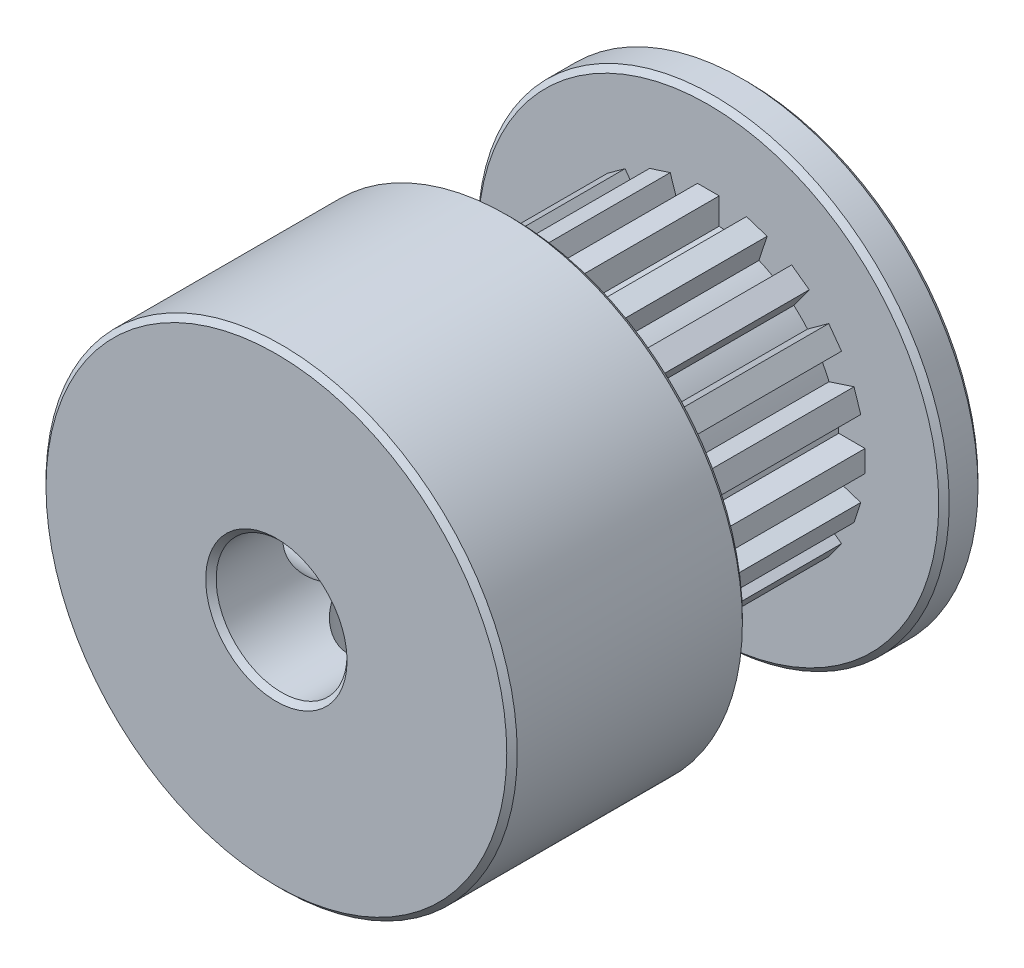
from build123d import *

# Parameters (mm, degrees)
SKETCH_1_R          = 9
SKETCH_1_R_2        = 2.5
EXTRUDE_1_DEPTH     = 1.5
SKETCH_2_R          = 2.5
EXTRUDE_2_DEPTH     = 7.5
SKETCH_3_R          = 9
SKETCH_3_R_2        = 2.5
EXTRUDE_3_DEPTH     = 9
CHAMFER_2_SIZE      = 0.2
SKETCH_4_R          = 1.75
CUT_EXTRUDE_1_DEPTH = 10
SKETCH_5_R          = 1.75
CUT_EXTRUDE_2_DEPTH = 10


with BuildPart() as part:
    # 草图1 → 凸台-拉伸1 (new body)
    with BuildSketch(Plane.XY):
        Circle(SKETCH_1_R)
        Circle(SKETCH_1_R_2, mode=Mode.SUBTRACT)
    extrude(amount=EXTRUDE_1_DEPTH)

    # 草图2 → 凸台-拉伸2 (add)
    with BuildSketch(Plane.XY.offset(1.5)):
        with BuildLine():
            Line((-0.415, 5.98563071), (-0.415, 4.982747736))
            ThreePointArc((-0.415, 4.982747736), (-0.782172325, 4.938441703), (-1.145065275, 4.867116756))
            Line((-1.145065275, 4.867116756), (-1.454973157, 5.820915144))
            Line((-1.454973157, 5.820915144), (-2.244350066, 5.564431038))
            Line((-2.244350066, 5.564431038), (-1.934442183, 4.610632651))
            ThreePointArc((-1.934442183, 4.610632651), (-2.269952499, 4.455032621), (-2.593043582, 4.275058477))
            Line((-2.593043582, 4.275058477), (-3.182523405, 5.086407846))
            Line((-3.182523405, 5.086407846), (-3.85400751, 4.598546087))
            Line((-3.85400751, 4.598546087), (-3.264527688, 3.787196717))
            ThreePointArc((-3.264527688, 3.787196717), (-3.535533906, 3.535533906), (-3.787196717, 3.264527688))
            Line((-3.787196717, 3.264527688), (-4.598546087, 3.85400751))
            Line((-4.598546087, 3.85400751), (-5.086407846, 3.182523405))
            Line((-5.086407846, 3.182523405), (-4.275058477, 2.593043582))
            ThreePointArc((-4.275058477, 2.593043582), (-4.455032621, 2.269952499), (-4.610632651, 1.934442183))
            Line((-4.610632651, 1.934442183), (-5.564431038, 2.244350066))
            Line((-5.564431038, 2.244350066), (-5.820915144, 1.454973157))
            Line((-5.820915144, 1.454973157), (-4.867116756, 1.145065275))
            ThreePointArc((-4.867116756, 1.145065275), (-4.938441703, 0.782172325), (-4.982747736, 0.415))
            Line((-4.982747736, 0.415), (-5.98563071, 0.415))
            Line((-5.98563071, 0.415), (-5.98563071, -0.415))
            Line((-5.98563071, -0.415), (-4.982747736, -0.415))
            ThreePointArc((-4.982747736, -0.415), (-4.938441703, -0.782172325), (-4.867116756, -1.145065275))
            Line((-4.867116756, -1.145065275), (-5.820915144, -1.454973157))
            Line((-5.820915144, -1.454973157), (-5.564431038, -2.244350066))
            Line((-5.564431038, -2.244350066), (-4.610632651, -1.934442183))
            ThreePointArc((-4.610632651, -1.934442183), (-4.455032621, -2.269952499), (-4.275058477, -2.593043582))
            Line((-4.275058477, -2.593043582), (-5.086407846, -3.182523405))
            Line((-5.086407846, -3.182523405), (-4.598546087, -3.85400751))
            Line((-4.598546087, -3.85400751), (-3.787196717, -3.264527688))
            ThreePointArc((-3.787196717, -3.264527688), (-3.535533906, -3.535533906), (-3.264527688, -3.787196717))
            Line((-3.264527688, -3.787196717), (-3.85400751, -4.598546087))
            Line((-3.85400751, -4.598546087), (-3.182523405, -5.086407846))
            Line((-3.182523405, -5.086407846), (-2.593043582, -4.275058477))
            ThreePointArc((-2.593043582, -4.275058477), (-2.269952499, -4.455032621), (-1.934442183, -4.610632651))
            Line((-1.934442183, -4.610632651), (-2.244350066, -5.564431038))
            Line((-2.244350066, -5.564431038), (-1.454973157, -5.820915144))
            Line((-1.454973157, -5.820915144), (-1.145065275, -4.867116756))
            ThreePointArc((-1.145065275, -4.867116756), (-0.782172325, -4.938441703), (-0.415, -4.982747736))
            Line((-0.415, -4.982747736), (-0.415, -5.98563071))
            Line((-0.415, -5.98563071), (0.415, -5.98563071))
            Line((0.415, -5.98563071), (0.415, -4.982747736))
            ThreePointArc((0.415, -4.982747736), (0.782172325, -4.938441703), (1.145065275, -4.867116756))
            Line((1.145065275, -4.867116756), (1.454973157, -5.820915144))
            Line((1.454973157, -5.820915144), (2.244350066, -5.564431038))
            Line((2.244350066, -5.564431038), (1.934442183, -4.610632651))
            ThreePointArc((1.934442183, -4.610632651), (2.269952499, -4.455032621), (2.593043582, -4.275058477))
            Line((2.593043582, -4.275058477), (3.182523405, -5.086407846))
            Line((3.182523405, -5.086407846), (3.85400751, -4.598546087))
            Line((3.85400751, -4.598546087), (3.264527688, -3.787196717))
            ThreePointArc((3.264527688, -3.787196717), (3.535533906, -3.535533906), (3.787196717, -3.264527688))
            Line((3.787196717, -3.264527688), (4.598546087, -3.85400751))
            Line((4.598546087, -3.85400751), (5.086407846, -3.182523405))
            Line((5.086407846, -3.182523405), (4.275058477, -2.593043582))
            ThreePointArc((4.275058477, -2.593043582), (4.455032621, -2.269952499), (4.610632651, -1.934442183))
            Line((4.610632651, -1.934442183), (5.564431038, -2.244350066))
            Line((5.564431038, -2.244350066), (5.820915144, -1.454973157))
            Line((5.820915144, -1.454973157), (4.867116756, -1.145065275))
            ThreePointArc((4.867116756, -1.145065275), (4.938441703, -0.782172325), (4.982747736, -0.415))
            Line((4.982747736, -0.415), (5.98563071, -0.415))
            Line((5.98563071, -0.415), (5.98563071, 0.415))
            Line((5.98563071, 0.415), (4.982747736, 0.415))
            ThreePointArc((4.982747736, 0.415), (4.938441703, 0.782172325), (4.867116756, 1.145065275))
            Line((4.867116756, 1.145065275), (5.820915144, 1.454973157))
            Line((5.820915144, 1.454973157), (5.564431038, 2.244350066))
            Line((5.564431038, 2.244350066), (4.610632651, 1.934442183))
            ThreePointArc((4.610632651, 1.934442183), (4.455032621, 2.269952499), (4.275058477, 2.593043582))
            Line((4.275058477, 2.593043582), (5.086407846, 3.182523405))
            Line((5.086407846, 3.182523405), (4.598546087, 3.85400751))
            Line((4.598546087, 3.85400751), (3.787196717, 3.264527688))
            ThreePointArc((3.787196717, 3.264527688), (3.535533906, 3.535533906), (3.264527688, 3.787196717))
            Line((3.264527688, 3.787196717), (3.85400751, 4.598546087))
            Line((3.85400751, 4.598546087), (3.182523405, 5.086407846))
            Line((3.182523405, 5.086407846), (2.593043582, 4.275058477))
            ThreePointArc((2.593043582, 4.275058477), (2.269952499, 4.455032621), (1.934442183, 4.610632651))
            Line((1.934442183, 4.610632651), (2.244350066, 5.564431038))
            Line((2.244350066, 5.564431038), (1.454973157, 5.820915144))
            Line((1.454973157, 5.820915144), (1.145065275, 4.867116756))
            ThreePointArc((1.145065275, 4.867116756), (0.782172325, 4.938441703), (0.415, 4.982747736))
            Line((0.415, 4.982747736), (0.415, 5.98563071))
            Line((0.415, 5.98563071), (-0.415, 5.98563071))
        make_face()
        Circle(SKETCH_2_R, mode=Mode.SUBTRACT)
    extrude(amount=EXTRUDE_2_DEPTH)

    # 草图3 → 凸台-拉伸3 (add)
    with BuildSketch(Plane.XY.offset(9)):
        Circle(SKETCH_3_R)
        Circle(SKETCH_3_R_2, mode=Mode.SUBTRACT)
    extrude(amount=EXTRUDE_3_DEPTH)

    # 倒角2
    chamfer_2_edges = [part.edges().sort_by_distance(p)[0] for p in [
        (-9, 0, 0),
        (-9, 0, 18),
        (-9, 0, 9),
        (-2.5, 0, 18),
        (-9, 0, 1.5),
        (-2.5, 0, 0),
    ]]
    chamfer(chamfer_2_edges, length=CHAMFER_2_SIZE)

    # 草图4 → 切除-拉伸1 (cut)
    with BuildSketch(Plane(origin=(0, 0, 0), x_dir=(1, 0, 0), z_dir=(0, 1, 0))):
        with Locations(Location((0, -13.5, 0), (0, 0, 270))):
            Circle(SKETCH_4_R)
    extrude(amount=-CUT_EXTRUDE_1_DEPTH, mode=Mode.SUBTRACT)

    # 草图5 → 切除-拉伸2 (cut)
    with BuildSketch(Plane(origin=(0, 0, 0), x_dir=(0, 0, -1), z_dir=(1, 0, 0))):
        with Locations(Location((-13.5, 0, 0), (0, 0, 180))):
            Circle(SKETCH_5_R)
    extrude(amount=-CUT_EXTRUDE_2_DEPTH, mode=Mode.SUBTRACT)


solid = part.part
